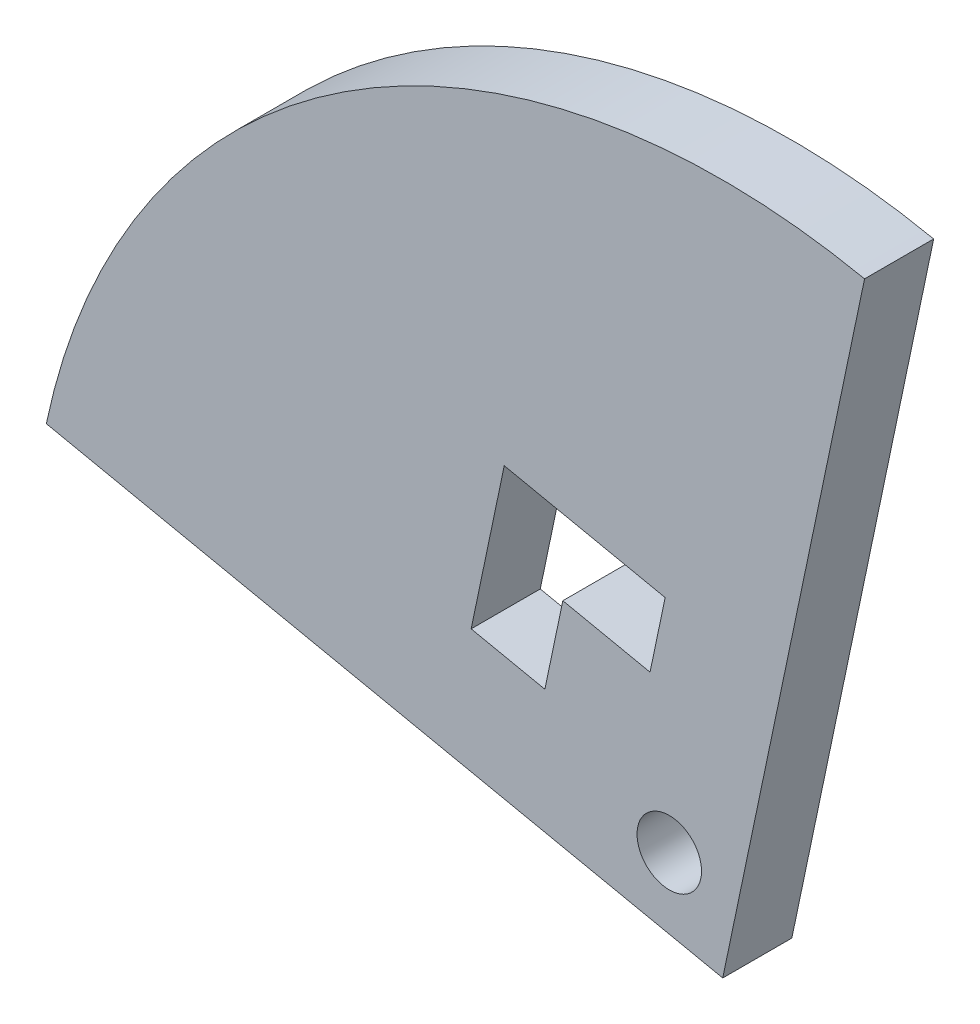
from build123d import *

# Parameters (mm, degrees)
BOSS_EXTRUDE2_DEPTH = 3.81
SKETCH3_R           = 1.778
CUT_EXTRUDE1_DEPTH  = 83.609172725
CUT_EXTRUDE2_DEPTH  = 83.609172725


with BuildPart() as part:
    # Sketch2 → Boss-Extrude2 (new body)
    with BuildSketch(Plane.XY):
        with BuildLine():
            Line((-11.22087151, 59.495333804), (-19.039557078, 22.20621802))
            Line((-19.039557078, 22.20621802), (-56.328672862, 30.024903588))
            ThreePointArc((-56.328672862, 30.024903588), (-39.878298128, 54.102250241), (-11.22087151, 59.495333804))
        make_face()
    extrude(amount=BOSS_EXTRUDE2_DEPTH)

    # Sketch3 → Cut-Extrude1 (cut, through all)
    with BuildSketch(Plane.XY.offset(3.81)):
        with Locations((-21.986600099, 26.716998155)):
            Circle(SKETCH3_R)
    extrude(amount=-CUT_EXTRUDE1_DEPTH, mode=Mode.SUBTRACT)

    # Sketch4 → Cut-Extrude2 (cut, through all)
    with BuildSketch(Plane(origin=(0, 0, 0), x_dir=(-1, 0, 0), z_dir=(0, 0, -1))):
        Polygon((31.084073207, 40.641701891), (22.213000878, 38.781638338), (23.046994005, 34.804132654), (31.918066334, 36.664196207), align=None)
        Polygon((32.908433172, 31.940908208), (31.918066334, 36.664196207), (27.854066334, 35.812067175), (28.844433172, 31.088779176), align=None)
    extrude(amount=-CUT_EXTRUDE2_DEPTH, mode=Mode.SUBTRACT)


solid = part.part
